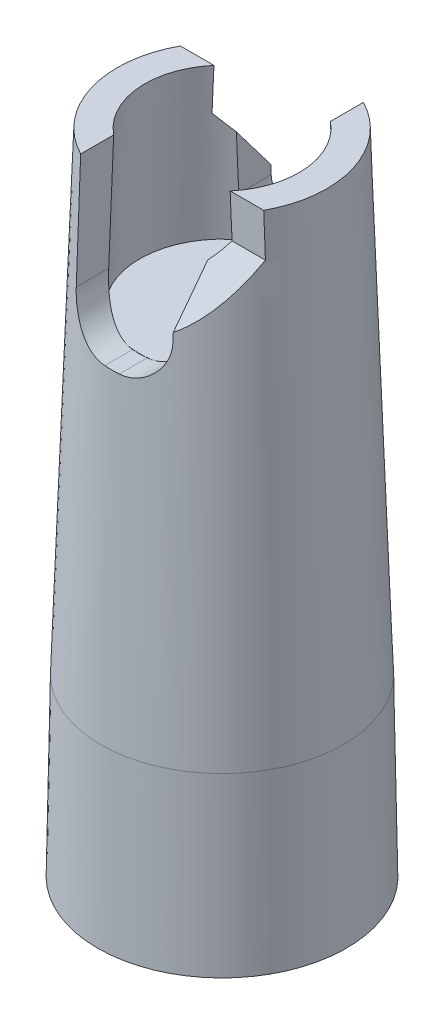
from build123d import *

# Parameters (mm, degrees)
SKETCH1_R                   = 2.9972
INSERT_DEPTH                = 11.684
INSERT_TAPER                = 2
INSERT_OTHER_WAY_DEPTH      = 4.318
INSERT_OTHER_WAY_TAPER      = -1
SKETCH2_R                   = 2.3114
INSERT_BORE_DEPTH           = 13.465843104
INSERT_BORE_TAPER           = 2
INSERT_BORE_OTHER_WAY_DEPTH = 13.465843104
PASS_CUT_DEPTH              = 13.465843104
PASS_CUT_DEPTH_BACK         = 13.465843104
PASS_CHIP_DEPTH             = 13.465843104
CIRPATTERN1_COUNT           = 2
SKETCH5_R                   = 2.032
BOSS_EXTRUDE1_DEPTH         = 1.0922


with BuildPart() as part:
    # Sketch1 → insert (new body)
    with BuildSketch(Plane(origin=(0, 0, 0), x_dir=(1, 0, 0), z_dir=(0, 1, 0))):
        Circle(SKETCH1_R)
    extrude(amount=INSERT_DEPTH, taper=INSERT_TAPER)

    # Sketch1 → insert other way (add)
    with BuildSketch(Plane(origin=(0, 0, 0), x_dir=(1, 0, 0), z_dir=(0, 1, 0))):
        Circle(SKETCH1_R)
    extrude(amount=-INSERT_OTHER_WAY_DEPTH, taper=INSERT_OTHER_WAY_TAPER)

    # Sketch2 → insert bore (cut)
    with BuildSketch(Plane.XZ):
        with Locations(Location((0, 0, 0), (0, 0, 270))):
            Circle(SKETCH2_R)
    extrude(amount=-INSERT_BORE_DEPTH, taper=INSERT_BORE_TAPER, mode=Mode.SUBTRACT)

    # Sketch2 → insert bore other way (cut)
    with BuildSketch(Plane.XZ):
        with Locations(Location((0, 0, 0), (0, 0, 270))):
            Circle(SKETCH2_R)
    extrude(amount=INSERT_BORE_OTHER_WAY_DEPTH, mode=Mode.SUBTRACT)

    # Sketch3 → pass cut (cut, two sides: drawn at the far end of the back side and taken through both)
    with BuildSketch(Plane.XY.offset(-PASS_CUT_DEPTH_BACK)):
        with BuildLine():
            Line((-1.1938, 11.684), (1.1938, 11.684))
            Line((1.1938, 11.684), (1.1938, 8.89))
            ThreePointArc((1.1938, 8.89), (0.89622049, 8.17157951), (0.1778, 7.874))
            Line((0.1778, 7.874), (-0.1778, 7.874))
            ThreePointArc((-0.1778, 7.874), (-0.89622049, 8.17157951), (-1.1938, 8.89))
            Line((-1.1938, 8.89), (-1.1938, 11.684))
        make_face()
    extrude(amount=PASS_CUT_DEPTH + PASS_CUT_DEPTH_BACK, mode=Mode.SUBTRACT)

    # Sketch4 → pass chip (cut, through all)
    with BuildSketch(Plane(origin=(0, 0, 0), x_dir=(0, 0, -1), z_dir=(1, 0, 0))):
        Polygon((1.242429972, 11.684), (2.707189518, 11.684), (2.707189518, 8.703141678), (1.242429972, 10.638716792), align=None)
    pass_chip = extrude(amount=-PASS_CHIP_DEPTH, mode=Mode.SUBTRACT)

    # CirPattern1: pass chip ×2 about axis
    cirpattern1_axis = Axis((0, -4.318, 0), (0, 1, 0))
    for i in range(1, CIRPATTERN1_COUNT):
        add(pass_chip.rotate(cirpattern1_axis, i * 360 / CIRPATTERN1_COUNT), mode=Mode.SUBTRACT)


with BuildPart() as body_2:
    # Sketch5 → Boss-Extrude1 (new body)
    with BuildSketch(Plane(origin=(0, 7.874, 0), x_dir=(-1, 0, 0), z_dir=(0, -1, 0))):
        with Locations(Location((0, 0, 0), (0, 0, 90))):
            Circle(SKETCH5_R)
    extrude(amount=BOSS_EXTRUDE1_DEPTH)


solid = Compound([part.part, body_2.part])
